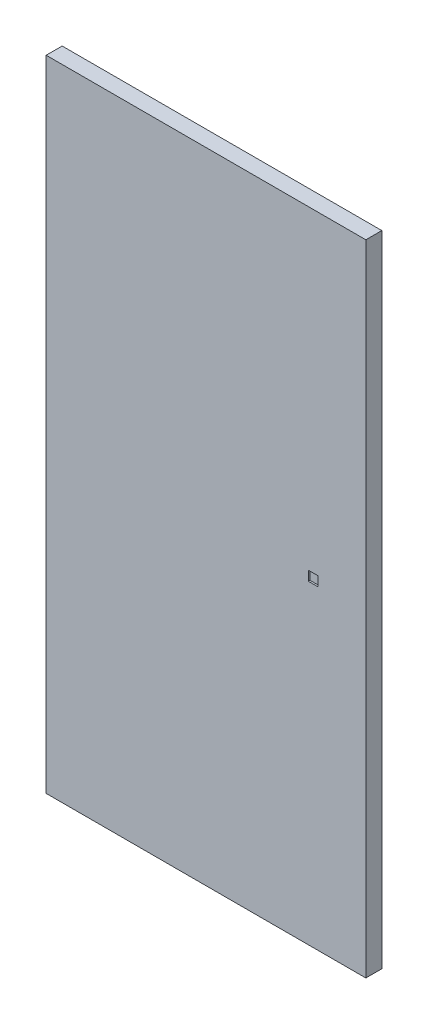
from build123d import *

# Parameters (mm, degrees)
SKETCH1_W           = 1000
SKETCH1_H           = 2000
BOSS_EXTRUDE1_DEPTH = 50
SKETCH2_W           = 30
SKETCH2_H           = 30
CUT_EXTRUDE1_DEPTH  = 5
SKETCH3_W           = 30
SKETCH3_H           = 30
CUT_EXTRUDE2_DEPTH  = 5


with BuildPart() as part:
    # Sketch1 → Boss-Extrude1 (new body)
    with BuildSketch(Plane.XY):
        Rectangle(SKETCH1_W, SKETCH1_H)
    extrude(amount=BOSS_EXTRUDE1_DEPTH)

    # Sketch2 → Cut-Extrude1 (cut)
    with BuildSketch(Plane.XY.offset(50)):
        with Locations((335, 0)):
            Rectangle(SKETCH2_W, SKETCH2_H)
    extrude(amount=-CUT_EXTRUDE1_DEPTH, mode=Mode.SUBTRACT)

    # Sketch3 → Cut-Extrude2 (cut)
    with BuildSketch(Plane(origin=(0, 0, 0), x_dir=(-1, 0, 0), z_dir=(0, 0, -1))):
        with Locations((-335, 0)):
            Rectangle(SKETCH3_W, SKETCH3_H)
    extrude(amount=-CUT_EXTRUDE2_DEPTH, mode=Mode.SUBTRACT)


solid = part.part
